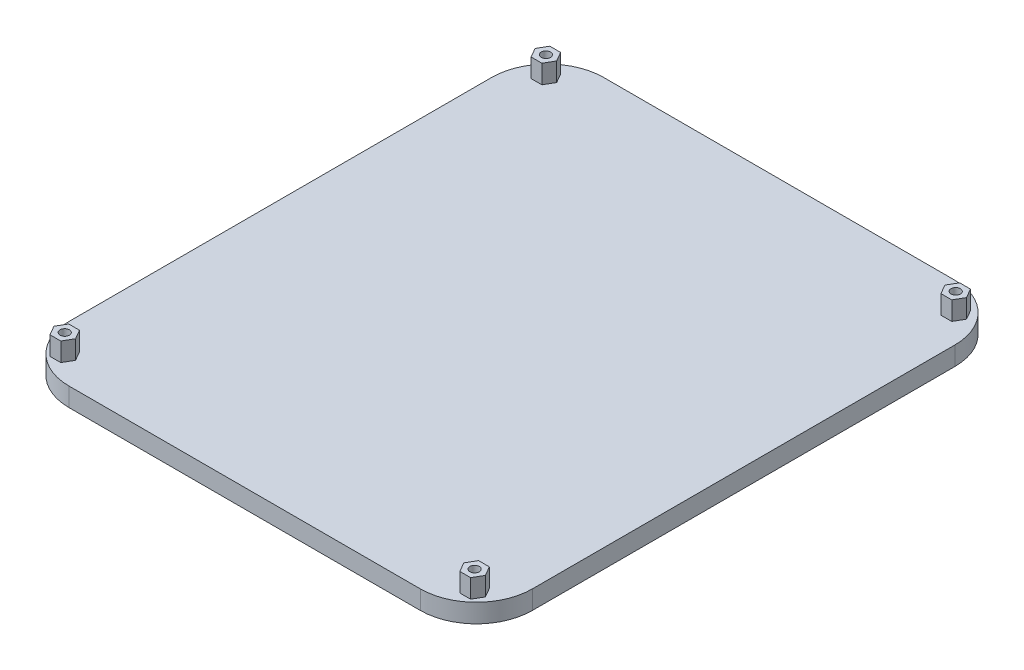
from build123d import *

# Parameters (mm, degrees)
FLOOR_2_DEPTH       = 5
SKETCH2_R           = 1.25
BOSS_EXTRUDE1_DEPTH = 5


with BuildPart() as part:
    # Sketch1 → Floor 2 (new body)
    with BuildSketch(Plane(origin=(0, 0, 0), x_dir=(1, 0, 0), z_dir=(0, 1, 0))):
        with BuildLine():
            Line((-46.9525, -71.4375), (46.9525, -71.4375))
            ThreePointArc((46.9525, -71.4375), (57.530817447, -67.055817447), (61.9125, -56.4775))
            Line((61.9125, -56.4775), (61.9125, 56.4775))
            ThreePointArc((61.9125, 56.4775), (57.530817447, 67.055817447), (46.9525, 71.4375))
            Line((46.9525, 71.4375), (-46.9525, 71.4375))
            ThreePointArc((-46.9525, 71.4375), (-57.530817447, 67.055817447), (-61.9125, 56.4775))
            Line((-61.9125, 56.4775), (-61.9125, -56.4775))
            ThreePointArc((-61.9125, -56.4775), (-57.530817447, -67.055817447), (-46.9525, -71.4375))
        make_face()
    extrude(amount=FLOOR_2_DEPTH)

    # Sketch2 → Boss-Extrude1 (add)
    # profile 1 of 4: a face of its own
    with BuildSketch(Plane(origin=(0, 5, 0), x_dir=(1, 0, 0), z_dir=(0, 1, 0))):
        Polygon((-56.370875673, -62.1125), (-57.814251346, -64.6125), (-56.370875673, -67.1125), (-53.484124327, -67.1125), (-52.040748654, -64.6125), (-53.484124327, -62.1125), align=None)
        with Locations(Location((-54.9275, -64.6125, 0), (0, 0, 270))):
            Circle(SKETCH2_R, mode=Mode.SUBTRACT)
    # profile 2 of 4: a face of its own
    with BuildSketch(Plane(origin=(0, 5, 0), x_dir=(1, 0, 0), z_dir=(0, 1, 0))):
        Polygon((56.055875673, -62.1125), (53.169124327, -62.1125), (51.725748654, -64.6125), (53.169124327, -67.1125), (56.055875673, -67.1125), (57.499251346, -64.6125), align=None)
        with Locations(Location((54.6125, -64.6125, 0), (0, 0, 270))):
            Circle(SKETCH2_R, mode=Mode.SUBTRACT)
    # profile 3 of 4: a face of its own
    with BuildSketch(Plane(origin=(0, 5, 0), x_dir=(1, 0, 0), z_dir=(0, 1, 0))):
        Polygon((-56.370875673, 66.4775), (-57.814251346, 63.9775), (-56.370875673, 61.4775), (-53.484124327, 61.4775), (-52.040748654, 63.9775), (-53.484124327, 66.4775), align=None)
        with Locations(Location((-54.9275, 63.9775, 0), (0, 0, 270))):
            Circle(SKETCH2_R, mode=Mode.SUBTRACT)
    # profile 4 of 4: a face of its own
    with BuildSketch(Plane(origin=(0, 5, 0), x_dir=(1, 0, 0), z_dir=(0, 1, 0))):
        Polygon((57.499251346, 63.9775), (56.055875673, 66.4775), (53.169124327, 66.4775), (51.725748654, 63.9775), (53.169124327, 61.4775), (56.055875673, 61.4775), align=None)
        with Locations(Location((54.6125, 63.9775, 0), (0, 0, 270))):
            Circle(SKETCH2_R, mode=Mode.SUBTRACT)
    extrude(amount=BOSS_EXTRUDE1_DEPTH)


solid = part.part
